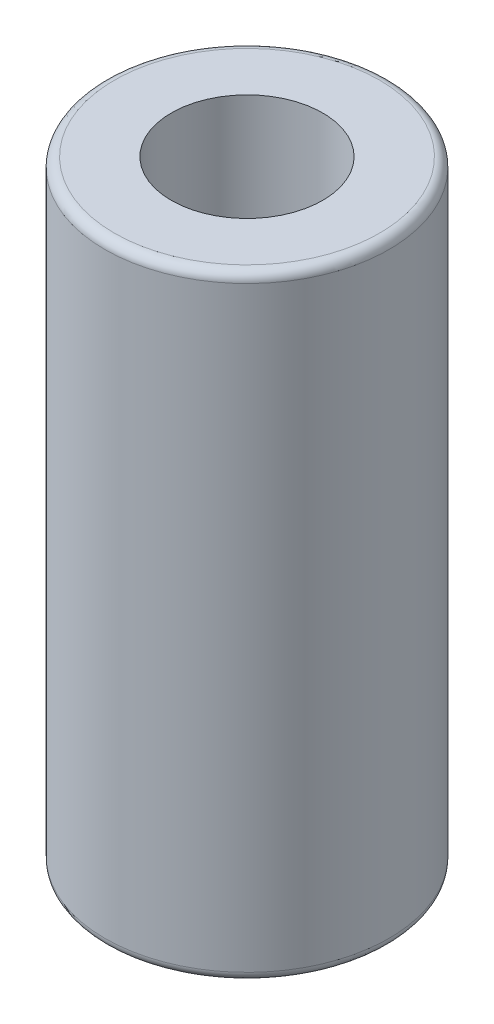
from build123d import *

# Parameters (mm, degrees)
SKETCH1_R           = 3
BOSS_EXTRUDE1_DEPTH = 13
SKETCH2_R           = 1.6
CUT_EXTRUDE1_DEPTH  = 14.674794331
FILLET1_R           = 0.2


with BuildPart() as part:
    # Sketch1 → Boss-Extrude1 (new body)
    with BuildSketch(Plane(origin=(0, 0, 0), x_dir=(1, 0, 0), z_dir=(0, 1, 0))):
        with Locations(Location((0, 0, 0), (0, 0, 90))):
            Circle(SKETCH1_R)
    extrude(amount=BOSS_EXTRUDE1_DEPTH)

    # Sketch2 → Cut-Extrude1 (cut, through all)
    with BuildSketch(Plane(origin=(0, 13, 0), x_dir=(1, 0, 0), z_dir=(0, 1, 0))):
        with Locations(Location((0, 0, 0), (0, 0, 270))):
            Circle(SKETCH2_R)
    extrude(amount=-CUT_EXTRUDE1_DEPTH, mode=Mode.SUBTRACT)

    # Fillet1
    fillet1_edges = [part.edges().sort_by_distance(p)[0] for p in [
        (0, 0, 3),
        (0, 13, 3),
    ]]
    fillet(fillet1_edges, radius=FILLET1_R)


solid = part.part
